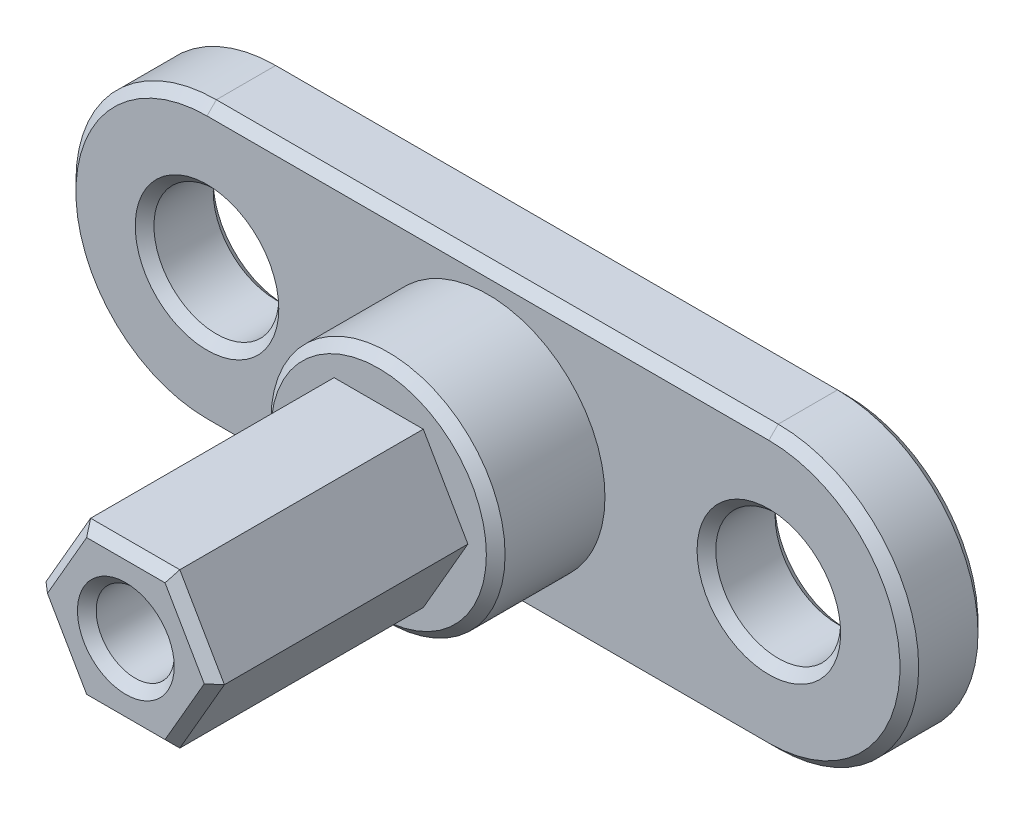
from build123d import *

# Parameters (mm, degrees)
BOSS_EXTRUDE1_DEPTH = 16.2
SKETCH2_R           = 7.5
BOSS_EXTRUDE2_DEPTH = 7
SKETCH3_R           = 4
BOSS_EXTRUDE3_DEPTH = 5
SKETCH4_R           = 2.5
CUT_EXTRUDE1_DEPTH  = 20
CHAMFER1_SIZE       = 0.6
SCALE1_SCALE        = 0.4


with BuildPart() as part:
    # Sketch1 → Boss-Extrude1 (new body)
    with BuildSketch(Plane.XY):
        Polygon((2.857883832, -4.95), (5.715767665, 0), (2.857883832, 4.95), (-2.857883832, 4.95), (-5.715767665, 0), (-2.857883832, -4.95), align=None)
    extrude(amount=BOSS_EXTRUDE1_DEPTH)

    # Sketch2 → Boss-Extrude2 (add)
    with BuildSketch(Plane.XY):
        Circle(SKETCH2_R)
    extrude(amount=-BOSS_EXTRUDE2_DEPTH)

    # Sketch3 → Boss-Extrude3 (add)
    with BuildSketch(Plane(origin=(0, 0, -7), x_dir=(-1, 0, 0), z_dir=(0, 0, -1))):
        with BuildLine():
            Line((-18, 9), (18, 9))
            ThreePointArc((18, 9), (27, 0), (18, -9))
            Line((18, -9), (-18, -9))
            ThreePointArc((-18, -9), (-27, 0), (-18, 9))
        make_face()
        with Locations((-18, 0)):
            Circle(SKETCH3_R, mode=Mode.SUBTRACT)
        with Locations((18, 0)):
            Circle(SKETCH3_R, mode=Mode.SUBTRACT)
    extrude(amount=BOSS_EXTRUDE3_DEPTH)

    # Sketch4 → Cut-Extrude1 (cut)
    with BuildSketch(Plane.XY.offset(16.2)):
        Circle(SKETCH4_R)
    extrude(amount=-CUT_EXTRUDE1_DEPTH, mode=Mode.SUBTRACT)

    # Chamfer1
    chamfer1_edges = [part.edges().sort_by_distance(p)[0] for p in [
        (4.286825749, 2.475, 16.2),
        (0, 4.95, 16.2),
        (-7.5, 0, 0),
        (-4.286825749, 2.475, 16.2),
        (-4.286825749, -2.475, 16.2),
        (27, 0, -12),
        (0, -9, -12),
        (-27, 0, -12),
        (0, 9, -12),
        (22, 0, -7),
        (-14, 0, -7),
        (27, 0, -7),
        (0, -9, -7),
        (-27, 0, -7),
        (0, 9, -7),
        (22, 0, -12),
        (-14, 0, -12),
        (-2.5, 0, 16.2),
        (0, -4.95, 16.2),
        (4.286825749, -2.475, 16.2),
    ]]
    chamfer(chamfer1_edges, length=CHAMFER1_SIZE)


with BuildPart() as part_1:
    # Scale1: scaled about (0, 0, -5.408282587)
    add(part.part.scale(SCALE1_SCALE).moved(Location((0, 0, -3.244969552))))


solid = part_1.part
